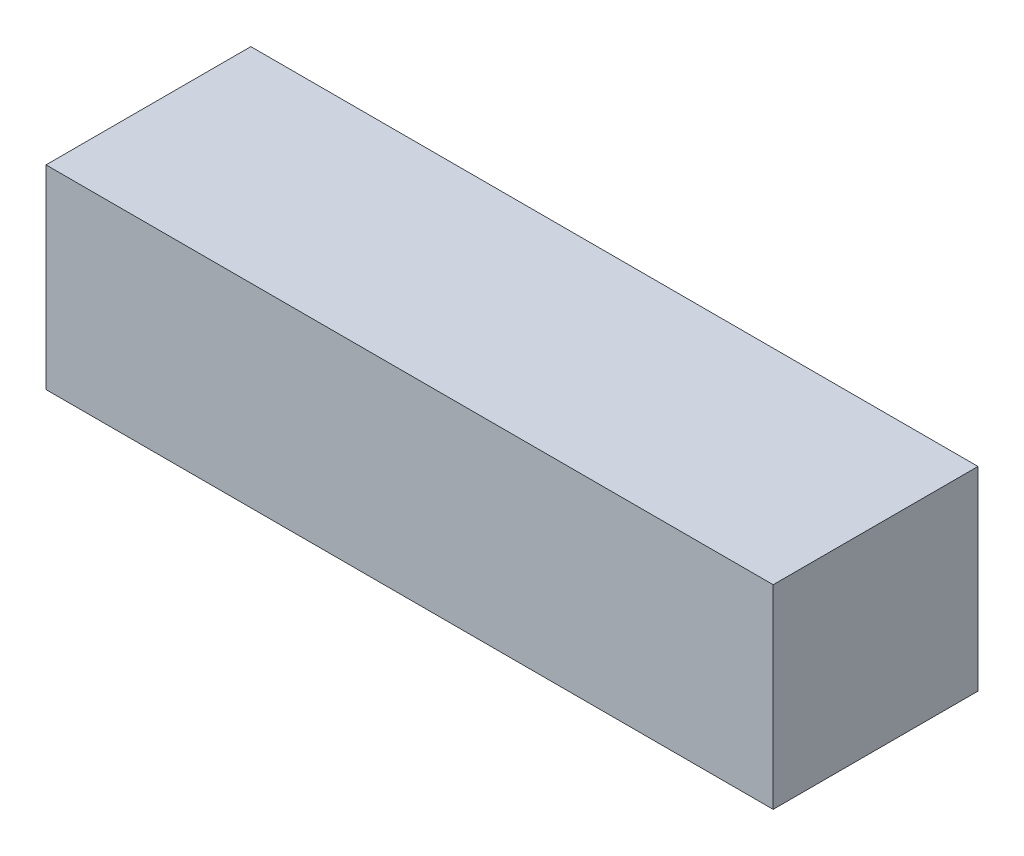
from build123d import *

# Parameters (mm, degrees)
SKETCH_1_W      = 142
SKETCH_1_H      = 40
EXTRUDE_1_DEPTH = 38


with BuildPart() as part:
    # 草图1 → 凸台-拉伸1 (new body)
    with BuildSketch(Plane(origin=(0, 0, 0), x_dir=(1, 0, 0), z_dir=(0, 1, 0))):
        Rectangle(SKETCH_1_W, SKETCH_1_H)
    extrude(amount=EXTRUDE_1_DEPTH)


solid = part.part
